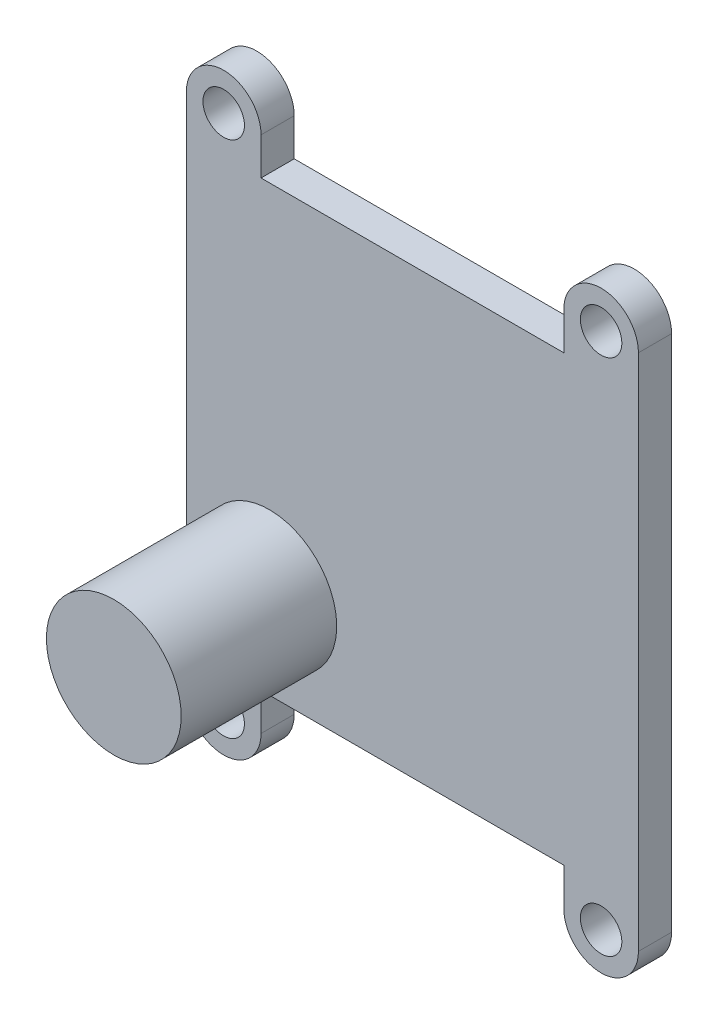
from build123d import *

# Parameters (mm, degrees)
SKETCH1_R           = 1
BOSS_EXTRUDE1_DEPTH = 1.6
SKETCH2_R           = 3.25
BOSS_EXTRUDE2_DEPTH = 7.5


with BuildPart() as part:
    # Sketch1 → Boss-Extrude1 (new body)
    with BuildSketch(Plane.XY):
        with BuildLine():
            Line((-10.9, 10.7), (-10.9, -10.7))
            Line((-10.9, -10.7), (-10.9, -12.5))
            ThreePointArc((-10.9, -12.5), (-9.1, -14.3), (-7.3, -12.5))
            Line((-7.3, -12.5), (-7.3, -10.7))
            Line((-7.3, -10.7), (7.3, -10.7))
            Line((7.3, -10.7), (7.3, -12.5))
            ThreePointArc((7.3, -12.5), (9.1, -14.3), (10.9, -12.5))
            Line((10.9, -12.5), (10.9, -10.7))
            Line((10.9, -10.7), (10.9, 10.7))
            Line((10.9, 10.7), (10.9, 12.5))
            ThreePointArc((10.9, 12.5), (9.1, 14.3), (7.3, 12.5))
            Line((7.3, 12.5), (7.3, 10.7))
            Line((7.3, 10.7), (-7.3, 10.7))
            Line((-7.3, 10.7), (-7.3, 12.5))
            ThreePointArc((-7.3, 12.5), (-9.1, 14.3), (-10.9, 12.5))
            Line((-10.9, 12.5), (-10.9, 10.7))
        make_face()
        with Locations((-9.1, 12.5)):
            Circle(SKETCH1_R, mode=Mode.SUBTRACT)
        with Locations(Location((9.1, 12.5, 0), (0, 0, 180))):
            Circle(SKETCH1_R, mode=Mode.SUBTRACT)
        with Locations((9.1, -12.5)):
            Circle(SKETCH1_R, mode=Mode.SUBTRACT)
        with Locations(Location((-9.1, -12.5, 0), (0, 0, 180))):
            Circle(SKETCH1_R, mode=Mode.SUBTRACT)
    extrude(amount=BOSS_EXTRUDE1_DEPTH)

    # Sketch2 → Boss-Extrude2 (add)
    with BuildSketch(Plane.XY.offset(1.6)):
        with Locations(Location((-6.9, -6.2, 0), (0, 0, 180))):
            Circle(SKETCH2_R)
    extrude(amount=BOSS_EXTRUDE2_DEPTH)


solid = part.part
